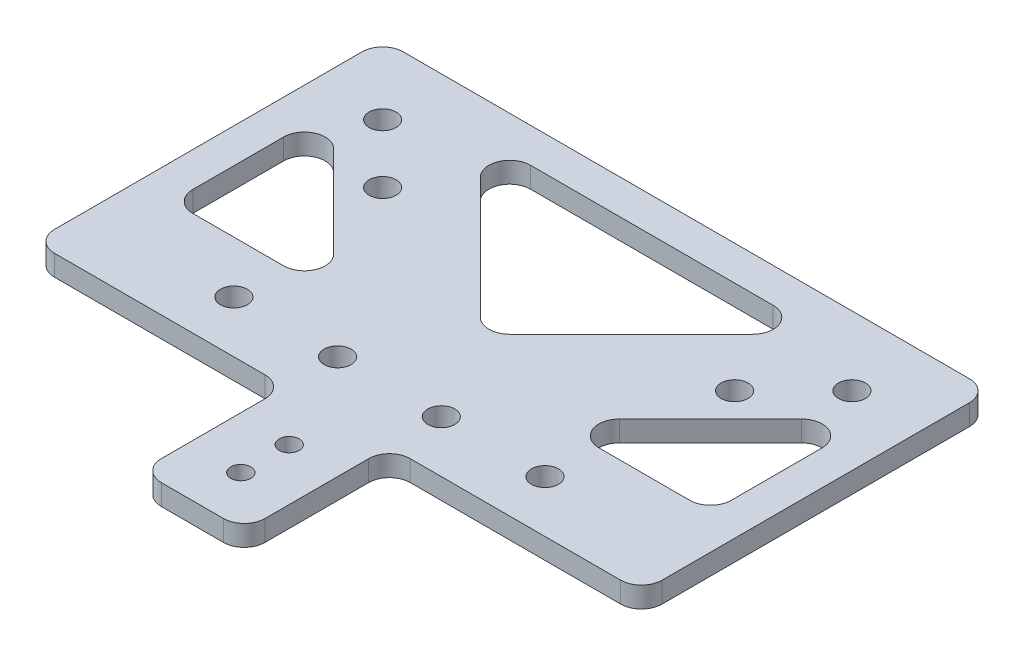
from build123d import *

# Parameters (mm, degrees)
SKETCH_2_R      = 1.95
SKETCH_2_R_2    = 1.45
EXTRUDE_3_DEPTH = 3
FILLET_2_R      = 3


with BuildPart() as part:
    # 草图2 → 凸台-拉伸3 (new body)
    with BuildSketch(Plane(origin=(0, 0, 0), x_dir=(1, 0, 0), z_dir=(0, 1, 0))):
        Polygon((-43.941125497, -7.5), (-43.941125497, 7.5), (-43.941125497, 42.955844123), (43.941125497, 42.955844123), (43.941125497, 7.5), (43.941125497, -7.5), (7.5, -7.5), (7.5, -28.5), (-7.5, -28.5), (-7.5, -7.5), align=None)
        with Locations(Location((25.455844123, 24.470562748, 0), (0, 0, 270))):
            Circle(SKETCH_2_R, mode=Mode.SUBTRACT)
        with Locations(Location((33.941125497, 32.955844123, 0), (0, 0, 270))):
            Circle(SKETCH_2_R, mode=Mode.SUBTRACT)
        with Locations(Location((7.5, 0, 0), (0, 0, 270))):
            Circle(SKETCH_2_R, mode=Mode.SUBTRACT)
        with Locations(Location((22.5, 0, 0), (0, 0, 270))):
            Circle(SKETCH_2_R, mode=Mode.SUBTRACT)
        with Locations(Location((-33.941125497, 32.955844123, 0), (0, 0, 90))):
            Circle(SKETCH_2_R, mode=Mode.SUBTRACT)
        with Locations(Location((-25.455844123, 24.470562748, 0), (0, 0, 90))):
            Circle(SKETCH_2_R, mode=Mode.SUBTRACT)
        with Locations(Location((-22.5, 0, 0), (0, 0, 90))):
            Circle(SKETCH_2_R, mode=Mode.SUBTRACT)
        with Locations(Location((-7.5, 0, 0), (0, 0, 90))):
            Circle(SKETCH_2_R, mode=Mode.SUBTRACT)
        with Locations(Location((0, -14.5, 0), (0, 0, 270))):
            Circle(SKETCH_2_R_2, mode=Mode.SUBTRACT)
        with Locations(Location((0, -21.5, 0), (0, 0, 270))):
            Circle(SKETCH_2_R_2, mode=Mode.SUBTRACT)
        Polygon((38.941125497, 30.884776311), (15.556349186, 7.5), (38.941125497, 7.5), align=None, mode=Mode.SUBTRACT)
        Polygon((-15.556349186, 7.5), (-38.941125497, 7.5), (-38.941125497, 30.884776311), align=None, mode=Mode.SUBTRACT)
        Polygon((24.798989873, 37.955844123), (0, 13.156854249), (-24.798989873, 37.955844123), align=None, mode=Mode.SUBTRACT)
    extrude(amount=EXTRUDE_3_DEPTH)

    # 圆角2
    fillet_2_edges = [part.edges().sort_by_distance(p)[0] for p in [
        (43.941125497, 1.5, 7.5),
        (7.5, 1.5, 7.5),
        (7.5, 1.5, 28.5),
        (-7.5, 1.5, 28.5),
        (-7.5, 1.5, 7.5),
        (-43.941125497, 1.5, 7.5),
        (-43.941125497, 1.5, -42.955844123),
        (43.941125497, 1.5, -42.955844123),
        (38.941125497, 1.5, -7.5),
        (38.941125497, 1.5, -30.884776311),
        (15.556349186, 1.5, -7.5),
        (-15.556349186, 1.5, -7.5),
        (-38.941125497, 1.5, -30.884776311),
        (-38.941125497, 1.5, -7.5),
        (24.798989873, 1.5, -37.955844123),
        (-24.798989873, 1.5, -37.955844123),
        (0, 1.5, -13.156854249),
    ]]
    fillet(fillet_2_edges, radius=FILLET_2_R)


solid = part.part
